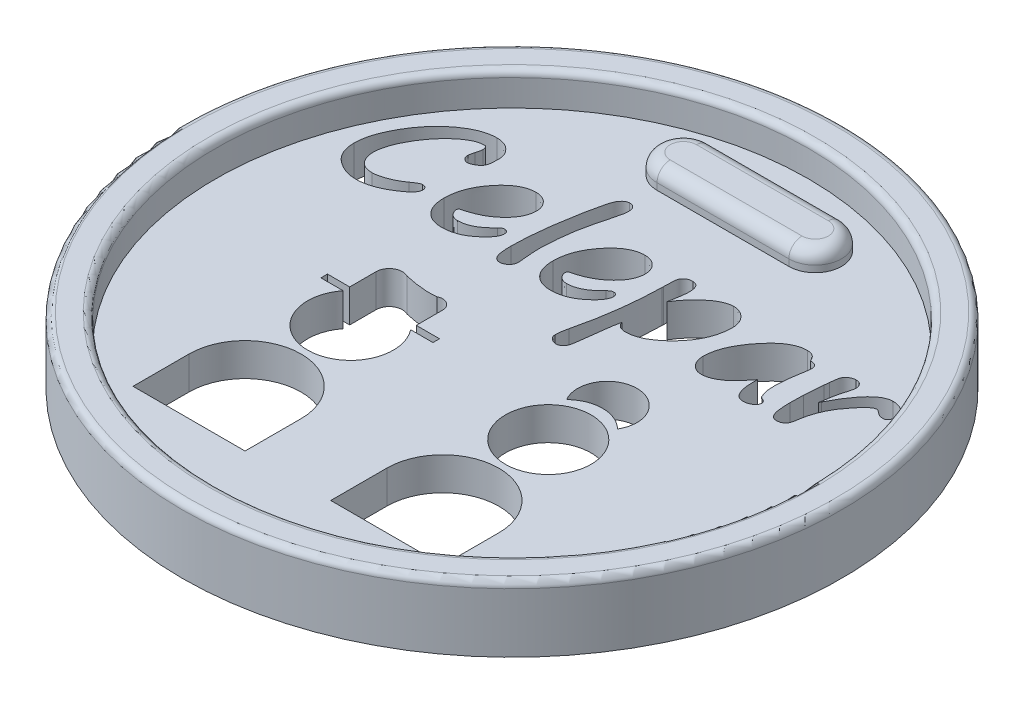
from build123d import *

# Parameters (mm, degrees)
SKETCH1_R           = 50
BOSS_EXTRUDE1_DEPTH = 10
SKETCH2_R           = 45
CUT_EXTRUDE1_DEPTH  = 5
CUT_EXTRUDE3_DEPTH  = 5
SKETCH4_R           = 6.5
CUT_EXTRUDE4_DEPTH  = 5
CUT_EXTRUDE5_DEPTH  = 5
BOSS_EXTRUDE2_DEPTH = 3
CUT_EXTRUDE9_DEPTH  = 5
CUT_EXTRUDE10_DEPTH = 5
FILLET3_R           = 1
FILLET4_R           = 2


with BuildPart() as part:
    # Sketch1 → Boss-Extrude1 (new body)
    with BuildSketch(Plane(origin=(0, 0, 0), x_dir=(1, 0, 0), z_dir=(0, 1, 0))):
        with Locations(Location((0, 0, 0), (0, 0, 270))):
            Circle(SKETCH1_R)
    extrude(amount=BOSS_EXTRUDE1_DEPTH)

    # Sketch2 → Cut-Extrude1 (cut)
    with BuildSketch(Plane(origin=(0, 10, 0), x_dir=(1, 0, 0), z_dir=(0, 1, 0))):
        with Locations(Location((0, 0, 0), (0, 0, 270))):
            Circle(SKETCH2_R)
    extrude(amount=-CUT_EXTRUDE1_DEPTH, mode=Mode.SUBTRACT)

    # Sketch3 → Cut-Extrude3 (cut)
    # profile 1 of 7: a face of its own
    with BuildSketch(Plane(origin=(0, 5, 0), x_dir=(1, 0, 0), z_dir=(0, 1, 0))):
        with BuildLine():
            add(Edge.make_bspline(
                [(-28.563958066, 14.976668611), (-28.504414468, 14.974726041), (-28.392027458, 14.971059488), (-28.236236874, 14.935447058), (-28.103393159, 14.878410499), (-27.992264837, 14.796973406), (-27.908901509, 14.68685804), (-27.849030657, 14.556229677), (-27.812800999, 14.403023682), (-27.809302498, 14.293538579), (-27.807431167, 14.234975573)],
                knots=[0, 0, 0, 0, 1.175922075, 2.219522687, 3.13882948, 4.018817675, 4.910676266, 5.838059115, 6.843589174, 8, 8, 8, 8], degree=3))
            add(Edge.make_bspline(
                [(-27.807431167, 14.234975573), (-27.815350699, 14.154926212), (-27.832269478, 13.983913893), (-27.946861005, 13.728461874), (-28.12364841, 13.462936918), (-28.367638487, 13.183557179), (-28.68240902, 12.89359431), (-29.067530825, 12.593852612), (-29.517459043, 12.275307778), (-30.024083276, 11.952178577), (-30.561692346, 11.640555951), (-31.109731426, 11.366432092), (-31.65265481, 11.134526199), (-32.190552702, 10.943614059), (-32.723674229, 10.794033502), (-33.252895244, 10.686184805), (-33.778938506, 10.622069038), (-34.128465653, 10.613718586), (-34.301695408, 10.609580004)],
                knots=[0, 0, 0, 0, 0.490997439, 1.048935432, 1.693710688, 2.446850553, 3.318610014, 4.31677211, 5.440051704, 6.701134426, 8.003547718, 9.252168074, 10.459584469, 11.62483034, 12.752871729, 13.855128834, 14.93697669, 16, 16, 16, 16], degree=3))
            add(Edge.make_bspline(
                [(-34.301695408, 10.609580004), (-34.452199777, 10.612715023), (-34.752298445, 10.618966104), (-35.196724045, 10.678097989), (-35.632941889, 10.768828796), (-36.058884592, 10.901757229), (-36.477040849, 11.06707691), (-36.886146898, 11.270149125), (-37.28435438, 11.512212559), (-37.670347842, 11.787060054), (-38.029332946, 12.098185014), (-38.343092254, 12.448034705), (-38.610922438, 12.831696822), (-38.827090515, 13.251130856), (-38.993485947, 13.705114508), (-39.115498294, 14.190048317), (-39.18704616, 14.710493974), (-39.195490993, 15.068413224), (-39.199836231, 15.252578421)],
                knots=[0, 0, 0, 0, 0.95508331, 1.904391418, 2.841495719, 3.780868837, 4.733410406, 5.693700699, 6.676790617, 7.689118492, 8.699107254, 9.686138951, 10.664969221, 11.661856379, 12.673015374, 13.72829804, 14.831109423, 16, 16, 16, 16], degree=3))
            add(Edge.make_bspline(
                [(-39.199836231, 15.252578421), (-39.195599761, 15.447657072), (-39.186965757, 15.845231034), (-39.103798446, 16.447798101), (-38.980051199, 17.067656115), (-38.802419335, 17.702089097), (-38.580611718, 18.354117617), (-38.301607084, 19.017914779), (-37.977266665, 19.699231167), (-37.60728269, 20.388485528), (-37.199337624, 21.069597119), (-36.762768195, 21.725311032), (-36.304903093, 22.351116476), (-35.823588635, 22.944075905), (-35.312729157, 23.50006827), (-34.782336603, 24.026250886), (-34.226572718, 24.519309481), (-33.652331049, 24.976146016), (-33.067836076, 25.390530095), (-32.482596876, 25.754104838), (-31.897504369, 26.055972509), (-31.321660954, 26.313921958), (-30.74426729, 26.505071423), (-30.172414672, 26.646804813), (-29.603028085, 26.733665549), (-29.223859837, 26.743793772), (-29.035674838, 26.74882051)],
                knots=[0, 0, 0, 0, 0.847673193, 1.727573926, 2.639890886, 3.594282358, 4.589527553, 5.632290013, 6.722685862, 7.869101956, 9.031879784, 10.173035523, 11.292655154, 12.401933248, 13.491379363, 14.573675912, 15.648732364, 16.71969745, 17.762273764, 18.76216988, 19.71212548, 20.622749067, 21.502397673, 22.352248691, 23.182204526, 24, 24, 24, 24], degree=3))
            add(Edge.make_bspline(
                [(-29.035674838, 26.74882051), (-28.92675849, 26.746961924), (-28.714133851, 26.743333624), (-28.403635011, 26.702728003), (-28.109514556, 26.641673116), (-27.832343528, 26.555235818), (-27.571670338, 26.446137267), (-27.33049959, 26.307204107), (-27.102773765, 26.147725863), (-26.897956723, 25.960338914), (-26.711510053, 25.759741082), (-26.547400298, 25.548394776), (-26.407753705, 25.329209241), (-26.292391598, 25.101284999), (-26.207762115, 24.863436302), (-26.144941223, 24.618254179), (-26.104395299, 24.364882817), (-26.100527609, 24.19260553), (-26.098570408, 24.105426523)],
                knots=[0, 0, 0, 0, 1.183925301, 2.31123878, 3.39976039, 4.447558897, 5.464427515, 6.466339261, 7.469116639, 8.482052617, 9.479102932, 10.445095484, 11.387997589, 12.301928294, 13.217187157, 14.127630168, 15.052508048, 16, 16, 16, 16], degree=3))
            add(Edge.make_bspline(
                [(-26.098570408, 24.105426523), (-26.100789073, 23.927373717), (-26.104898006, 23.597622835), (-26.135280693, 23.142517999), (-26.188244362, 22.767653468), (-26.266739709, 22.460804854), (-26.389306802, 22.204648141), (-26.559911509, 21.979574175), (-26.780733011, 21.772553245), (-27.043233152, 21.595028044), (-27.315037359, 21.448351853), (-27.566636927, 21.331058581), (-27.794835271, 21.260761822), (-27.939580774, 21.248250271), (-28.006204902, 21.242491396)],
                knots=[0, 0, 0, 0, 1.655393144, 3.065761008, 4.237347446, 5.171966553, 5.998538883, 6.859132817, 7.782696876, 8.800325899, 9.796079609, 10.652143033, 11.379602177, 12, 12, 12, 12], degree=3))
            add(Edge.make_bspline(
                [(-28.006204902, 21.242491396), (-28.067856028, 21.246029536), (-28.189327646, 21.253000757), (-28.364270277, 21.304899718), (-28.524963307, 21.39155505), (-28.672774575, 21.504764031), (-28.795892181, 21.650834234), (-28.882346026, 21.824978864), (-28.93789557, 22.021370276), (-28.943666999, 22.160802971), (-28.946671674, 22.233393295)],
                knots=[0, 0, 0, 0, 0.96832296, 1.907893094, 2.839715128, 3.825475609, 4.818685114, 5.812867401, 6.861352675, 8, 8, 8, 8], degree=3))
            add(Edge.make_bspline(
                [(-28.946671674, 22.233393295), (-28.944225491, 22.292907854), (-28.938843055, 22.423860181), (-28.893714829, 22.635972953), (-28.837131953, 22.885546003), (-28.781017214, 23.061508399), (-28.750864712, 23.156059434)],
                knots=[0, 0, 0, 0, 0.754148222, 1.659383275, 2.74230097, 4, 4, 4, 4], degree=3))
            add(Edge.make_bspline(
                [(-28.750864712, 23.156059434), (-28.723356446, 23.252750739), (-28.671162917, 23.436210519), (-28.609262947, 23.700858192), (-28.575923692, 23.941395916), (-28.569796588, 24.093480504), (-28.566924838, 24.164761966)],
                knots=[0, 0, 0, 0, 1.172701658, 2.225056214, 3.168090668, 4, 4, 4, 4], degree=3))
            add(Edge.make_bspline(
                [(-28.566924838, 24.164761966), (-28.567252392, 24.218313688), (-28.567868941, 24.319113226), (-28.593481512, 24.459052629), (-28.626078796, 24.579573258), (-28.67860607, 24.67803553), (-28.743284656, 24.757675018), (-28.826908552, 24.813577741), (-28.92604963, 24.842635808), (-28.995940224, 24.84751795), (-29.032708066, 24.850086333)],
                knots=[0, 0, 0, 0, 1.363882434, 2.567213775, 3.621257799, 4.53582974, 5.395465562, 6.214495348, 7.060686862, 8, 8, 8, 8], degree=3))
            add(Edge.make_bspline(
                [(-29.032708066, 24.850086333), (-29.153670056, 24.845251765), (-29.401533537, 24.835345241), (-29.778166859, 24.760203705), (-30.164371865, 24.637150449), (-30.560791133, 24.465345127), (-30.967484707, 24.247934971), (-31.383462345, 23.981090198), (-31.811987932, 23.668666134), (-32.243967534, 23.308863531), (-32.678491894, 22.918887622), (-33.094942039, 22.495730017), (-33.500122694, 22.053541454), (-33.888511461, 21.586774263), (-34.263152338, 21.09784586), (-34.617594223, 20.583165915), (-34.961536515, 20.048889726), (-35.278956747, 19.493717319), (-35.574469679, 18.938253002), (-35.828180219, 18.390168729), (-36.052564393, 17.863334187), (-36.224889964, 17.348081776), (-36.368064501, 16.853182505), (-36.465455073, 16.372942645), (-36.52825656, 15.909896047), (-36.537226961, 15.605810494), (-36.541608383, 15.4572857)],
                knots=[0, 0, 0, 0, 0.679891051, 1.393166261, 2.151189153, 2.955854646, 3.819108012, 4.74163671, 5.732685108, 6.799283363, 7.901667624, 9.014479954, 10.136314935, 11.273386669, 12.427880066, 13.598704419, 14.786520549, 15.999798709, 17.193781982, 18.323240499, 19.395217907, 20.411667901, 21.376421926, 22.290345904, 23.164952033, 24, 24, 24, 24], degree=3))
            add(Edge.make_bspline(
                [(-36.541608383, 15.4572857), (-36.538816045, 15.362302796), (-36.53333429, 15.175837846), (-36.505386617, 14.901367958), (-36.449166534, 14.639421147), (-36.381527945, 14.386482869), (-36.282839166, 14.148195302), (-36.17142421, 13.917094617), (-36.034506226, 13.699624281), (-35.880743595, 13.493336206), (-35.705917167, 13.305859824), (-35.509448848, 13.141016915), (-35.290575044, 13.005117669), (-35.055435743, 12.8909641), (-34.799945461, 12.805129476), (-34.526521676, 12.743919067), (-34.233662022, 12.703564397), (-34.031859641, 12.700015927), (-33.927882117, 12.698187598)],
                knots=[0, 0, 0, 0, 1.062708041, 2.086247047, 3.079703908, 4.056583884, 5.009566657, 5.959270479, 6.922975603, 7.878586239, 8.833236301, 9.783455216, 10.737784872, 11.707374597, 12.700708315, 13.744425971, 14.837828359, 16, 16, 16, 16], degree=3))
            add(Edge.make_bspline(
                [(-33.927882117, 12.698187598), (-33.794089918, 12.70425344), (-33.507808202, 12.717232817), (-33.055168294, 12.800459537), (-32.553834824, 12.932289466), (-32.015072939, 13.114710028), (-31.461699941, 13.337259003), (-30.919310287, 13.602756909), (-30.398294275, 13.904687845), (-30.069518059, 14.134679889), (-29.904939079, 14.249809434)],
                knots=[0, 0, 0, 0, 0.735103209, 1.572936311, 2.52174827, 3.581825056, 4.69567354, 5.796405863, 6.896923624, 8, 8, 8, 8], degree=3))
            add(Edge.make_bspline(
                [(-29.904939079, 14.249809434), (-29.826002893, 14.306426404), (-29.675963673, 14.414042017), (-29.46032557, 14.562928865), (-29.263277902, 14.688429911), (-29.08669489, 14.792366805), (-28.928886797, 14.874430567), (-28.7899988, 14.931217537), (-28.670498582, 14.966937017), (-28.596760103, 14.973672417), (-28.563958066, 14.976668611)],
                knots=[0, 0, 0, 0, 1.513238956, 2.876313183, 4.081465863, 5.151542836, 6.067858844, 6.848826273, 7.487908581, 8, 8, 8, 8], degree=3))
        make_face()
    # profile 2 of 7: a face of its own
    with BuildSketch(Plane(origin=(0, 5, 0), x_dir=(1, 0, 0), z_dir=(0, 1, 0))):
        with BuildLine():
            add(Edge.make_bspline(
                [(-15.845405851, 14.691858485), (-15.850730141, 14.603242927), (-15.861835223, 14.418413957), (-15.95285415, 14.139599782), (-16.092127819, 13.849737342), (-16.284143669, 13.546028196), (-16.533315651, 13.232591935), (-16.834506125, 12.906200428), (-17.190547864, 12.567927661), (-17.590035951, 12.222257312), (-18.02370685, 11.89017051), (-18.482394016, 11.598722511), (-18.954812514, 11.35005111), (-19.443925093, 11.152558257), (-19.944285618, 10.993180331), (-20.459495013, 10.879981088), (-20.990064451, 10.814355749), (-21.348589617, 10.80445564), (-21.529741294, 10.799453421)],
                knots=[0, 0, 0, 0, 0.575450738, 1.200240343, 1.890844749, 2.665472192, 3.531532002, 4.492194963, 5.552302139, 6.724526169, 7.927501424, 9.101753601, 10.255563892, 11.395209824, 12.528446857, 13.667874897, 14.821649321, 16, 16, 16, 16], degree=3))
            add(Edge.make_bspline(
                [(-21.529741294, 10.799453421), (-21.666372045, 10.802940292), (-21.933667107, 10.809761768), (-22.323057681, 10.860973319), (-22.689855969, 10.943442745), (-23.034750122, 11.059091366), (-23.35643211, 11.211913638), (-23.657698198, 11.395821113), (-23.935077329, 11.61423615), (-24.189082783, 11.864090486), (-24.412417477, 12.147296589), (-24.613833904, 12.453172954), (-24.780427366, 12.788010591), (-24.912611557, 13.150068435), (-25.020015665, 13.536775964), (-25.096581656, 13.949610618), (-25.141129716, 14.388258736), (-25.146463453, 14.68878681), (-25.149203319, 14.843163864)],
                knots=[0, 0, 0, 0, 1.066394267, 2.086220858, 3.060099066, 3.997587095, 4.919658394, 5.834591807, 6.74734032, 7.669928585, 8.60916332, 9.557774692, 10.524496789, 11.521150538, 12.562548157, 13.654267586, 14.795030173, 16, 16, 16, 16], degree=3))
            add(Edge.make_bspline(
                [(-25.149203319, 14.843163864), (-25.144147322, 15.075922409), (-25.134078465, 15.539453683), (-25.032768608, 16.22795323), (-24.881472119, 16.907247314), (-24.658309221, 17.573124124), (-24.379041743, 18.228710747), (-24.03536748, 18.872778597), (-23.626913095, 19.50377172), (-23.168257646, 20.114821293), (-22.674613087, 20.6820999), (-22.166218533, 21.187290508), (-21.643608078, 21.611380571), (-21.116003919, 21.962434819), (-20.575820011, 22.233432841), (-20.02803905, 22.427330395), (-19.470227037, 22.549419614), (-19.094621472, 22.56421786), (-18.907114712, 22.57160532)],
                knots=[0, 0, 0, 0, 1.031222844, 2.053647655, 3.078916673, 4.113182563, 5.162064125, 6.23490753, 7.345231, 8.491265058, 9.619269909, 10.676447627, 11.664492445, 12.598371341, 13.480677529, 14.336228692, 15.169425597, 16, 16, 16, 16], degree=3))
            add(Edge.make_bspline(
                [(-18.907114712, 22.57160532), (-18.816056857, 22.569096076), (-18.63730521, 22.564170289), (-18.375664921, 22.532325852), (-18.127978681, 22.474293288), (-17.891410331, 22.399730305), (-17.672956283, 22.293024383), (-17.465031049, 22.172356955), (-17.274016541, 22.024458545), (-17.097836496, 21.856759681), (-16.939594363, 21.67372232), (-16.797503281, 21.482613494), (-16.67922055, 21.281656705), (-16.583619264, 21.070263458), (-16.505987468, 20.852424653), (-16.452022939, 20.624666495), (-16.423198593, 20.388804196), (-16.417777831, 20.22891606), (-16.415026104, 20.147752472)],
                knots=[0, 0, 0, 0, 1.124451236, 2.207360486, 3.247069246, 4.262619894, 5.262188273, 6.242249166, 7.22648491, 8.237031366, 9.240990529, 10.210574094, 11.173909432, 12.113741425, 13.071488564, 14.025179417, 14.997527084, 16, 16, 16, 16], degree=3))
            add(Edge.make_bspline(
                [(-16.415026104, 20.147752472), (-16.420480844, 20.002067224), (-16.431428166, 19.709686014), (-16.510626119, 19.275007975), (-16.643159082, 18.846289567), (-16.82927119, 18.422937669), (-17.067433561, 18.004852832), (-17.358821926, 17.592728274), (-17.701262189, 17.186938814), (-18.090926056, 16.789303162), (-18.520193639, 16.409202881), (-18.985251341, 16.058400475), (-19.478653785, 15.738529404), (-19.999477685, 15.445153873), (-20.553027085, 15.188285129), (-21.134996782, 14.960891043), (-21.745139047, 14.758581276), (-22.166790276, 14.655349763), (-22.381204902, 14.60285532)],
                knots=[0, 0, 0, 0, 0.800849327, 1.607254681, 2.420833415, 3.263389909, 4.144929825, 5.06217423, 6.034821359, 7.061524084, 8.120941185, 9.184578394, 10.261477047, 11.352140241, 12.468738872, 13.613838751, 14.786608846, 16, 16, 16, 16], degree=3))
            add(Edge.make_bspline(
                [(-22.381204902, 14.60285532), (-22.425792705, 14.588589288), (-22.508765494, 14.562041839), (-22.613867236, 14.48447275), (-22.672648361, 14.369631114), (-22.678037272, 14.28504249), (-22.680848889, 14.240909117)],
                knots=[0, 0, 0, 0, 1.091319623, 2.030820704, 2.972597988, 4, 4, 4, 4], degree=3))
            add(Edge.make_bspline(
                [(-22.680848889, 14.240909117), (-22.675725935, 14.16107767), (-22.665350449, 13.999395562), (-22.577566493, 13.763402249), (-22.446074931, 13.532544533), (-22.262769354, 13.316099013), (-22.03759371, 13.124494949), (-21.767292218, 12.987547777), (-21.462888972, 12.900356226), (-21.247546813, 12.89227735), (-21.135160598, 12.888061016)],
                knots=[0, 0, 0, 0, 0.841016686, 1.703305588, 2.62977901, 3.638315365, 4.684301175, 5.730912823, 6.815772435, 8, 8, 8, 8], degree=3))
            add(Edge.make_bspline(
                [(-21.135160598, 12.888061016), (-20.969519024, 12.894365197), (-20.635397977, 12.907081566), (-20.136681602, 13.011268542), (-19.637712008, 13.171789961), (-19.140539321, 13.399791449), (-18.645832543, 13.693982073), (-18.152801379, 14.052992592), (-17.659420032, 14.474349278), (-17.347181134, 14.792211223), (-17.186386864, 14.955901206)],
                knots=[0, 0, 0, 0, 0.866839858, 1.74853109, 2.657591878, 3.607915725, 4.606351584, 5.667263571, 6.798706195, 8, 8, 8, 8], degree=3))
            add(Edge.make_bspline(
                [(-17.186386864, 14.955901206), (-17.124979767, 15.016578633), (-17.01015796, 15.130036071), (-16.819983218, 15.255810721), (-16.633783449, 15.342615328), (-16.505832697, 15.351953416), (-16.444693826, 15.356415447)],
                knots=[0, 0, 0, 0, 1.194390874, 2.233326893, 3.155828328, 4, 4, 4, 4], degree=3))
            add(Edge.make_bspline(
                [(-16.444693826, 15.356415447), (-16.397929613, 15.355539026), (-16.30901417, 15.353872637), (-16.185893088, 15.318960177), (-16.077250919, 15.269600475), (-15.990816492, 15.19329455), (-15.921489814, 15.097653737), (-15.880749769, 14.978984753), (-15.848107062, 14.842933406), (-15.846347571, 14.744527591), (-15.845405851, 14.691858485)],
                knots=[0, 0, 0, 0, 1.089782762, 2.0720656, 2.972437849, 3.858422398, 4.738038329, 5.704937711, 6.77162871, 8, 8, 8, 8], degree=3))
        make_face()
        with BuildLine():
            add(Edge.make_bspline(
                [(-22.50284256, 16.463021459), (-22.371893777, 16.492044144), (-22.112920638, 16.549441363), (-21.733416147, 16.663775652), (-21.366829064, 16.799606447), (-21.010996674, 16.958018832), (-20.666756785, 17.138768351), (-20.334870542, 17.343258322), (-20.016237285, 17.57104749), (-19.712117643, 17.812485217), (-19.43334619, 18.064920557), (-19.187892811, 18.315802815), (-18.977396721, 18.55899258), (-18.807391286, 18.797774011), (-18.670227853, 19.02958339), (-18.575490419, 19.258309186), (-18.513956887, 19.480964314), (-18.507010104, 19.62820514), (-18.503633699, 19.699769877)],
                knots=[0, 0, 0, 0, 1.183770719, 2.341104769, 3.495768463, 4.633072806, 5.777292541, 6.925767626, 8.071584969, 9.233257558, 10.352014072, 11.389210071, 12.330478683, 13.188063196, 13.974238553, 14.702222648, 15.369230003, 16, 16, 16, 16], degree=3))
            add(Edge.make_bspline(
                [(-18.503633699, 19.699769877), (-18.505597018, 19.753442697), (-18.509389502, 19.857120851), (-18.547671312, 20.004768101), (-18.602143045, 20.141738049), (-18.68666055, 20.258049606), (-18.783613457, 20.35847576), (-18.898226266, 20.431167448), (-19.027734507, 20.474652397), (-19.118405759, 20.480155959), (-19.165223889, 20.482997725)],
                knots=[0, 0, 0, 0, 1.123927722, 2.171056977, 3.184948799, 4.198415598, 5.167106761, 6.100000299, 7.018934543, 8, 8, 8, 8], degree=3))
            add(Edge.make_bspline(
                [(-19.165223889, 20.482997725), (-19.238724821, 20.4784365), (-19.390893056, 20.468993441), (-19.620799209, 20.407179544), (-19.854041091, 20.301962394), (-20.096483198, 20.163472177), (-20.337229113, 19.974088349), (-20.591736545, 19.756304027), (-20.846037345, 19.491019138), (-21.104182222, 19.194839939), (-21.356011327, 18.876925091), (-21.586934274, 18.547549652), (-21.796863408, 18.213323665), (-21.982013655, 17.872553801), (-22.150231243, 17.529583281), (-22.289548574, 17.178787486), (-22.408813195, 16.824231876), (-22.471588469, 16.583082924), (-22.50284256, 16.463021459)],
                knots=[0, 0, 0, 0, 0.642491747, 1.330144142, 2.06562385, 2.87509469, 3.76367731, 4.737815052, 5.801380817, 6.97148196, 8.171592185, 9.344244655, 10.485872232, 11.619289626, 12.73268851, 13.822553391, 14.915908914, 16, 16, 16, 16], degree=3))
        make_face(mode=Mode.SUBTRACT)
    # profile 3 of 7: a face of its own
    with BuildSketch(Plane(origin=(0, 5, 0), x_dir=(1, 0, 0), z_dir=(0, 1, 0))):
        with BuildLine():
            add(Edge.make_bspline(
                [(-10.457747623, 28.267807852), (-10.374358396, 28.264948438), (-10.215317165, 28.25949492), (-9.993494459, 28.203880502), (-9.805562753, 28.108925551), (-9.648282336, 27.979558855), (-9.532675912, 27.805917994), (-9.444311237, 27.601573593), (-9.400181084, 27.357809115), (-9.393351341, 27.1850716), (-9.389709648, 27.092966079)],
                knots=[0, 0, 0, 0, 1.099591197, 2.097157424, 2.990591671, 3.861609203, 4.752654967, 5.717909776, 6.783164693, 8, 8, 8, 8], degree=3))
            add(Edge.make_bspline(
                [(-9.389709648, 27.092966079), (-9.396877995, 26.905581426), (-9.411856794, 26.514027101), (-9.500720108, 26.06662706), (-9.584562529, 25.726299407), (-9.643255132, 25.483830634), (-9.71782131, 25.184292665), (-9.806207916, 24.827867939), (-9.913635109, 24.414645728), (-10.039352798, 23.944728365), (-10.174306693, 23.41474092), (-10.272506301, 23.043240532), (-10.324242876, 22.84751513)],
                knots=[0, 0, 0, 0, 1.289829287, 2.695195295, 3.129646155, 3.704501762, 4.413150189, 5.25559708, 6.233531093, 7.353588569, 8.605735134, 10, 10, 10, 10], degree=3))
            add(Edge.make_bspline(
                [(-10.324242876, 22.84751513), (-10.401038878, 22.544519454), (-10.557422118, 21.927515388), (-10.746418721, 20.973390237), (-10.913837467, 19.979377077), (-11.024511773, 19.130230886), (-11.097885747, 18.451883632), (-11.148003613, 17.968270979), (-11.194821624, 17.514710295), (-11.225824422, 17.089123526), (-11.252936934, 16.69159356), (-11.274273902, 16.322772074), (-11.287108718, 15.982498884), (-11.288011239, 15.765839805), (-11.288443826, 15.661992978)],
                knots=[0, 0, 0, 0, 1.548613178, 3.153512418, 4.817868451, 6.542840943, 7.395678594, 8.198748891, 8.952079032, 9.654882466, 10.312993058, 10.926481874, 11.485452204, 12, 12, 12, 12], degree=3))
            add(Edge.make_bspline(
                [(-11.288443826, 15.661992978), (-11.285938617, 15.44142131), (-11.280689413, 14.979253821), (-11.242590655, 14.257098364), (-11.183482175, 13.474616244), (-11.127607527, 12.934418), (-11.098570408, 12.653686016)],
                knots=[0, 0, 0, 0, 0.877690488, 1.839039493, 2.876985002, 4, 4, 4, 4], degree=3))
            add(Edge.make_bspline(
                [(-11.098570408, 12.653686016), (-11.091967553, 12.582450619), (-11.080133224, 12.45477507), (-11.060375084, 12.286054763), (-11.051025289, 12.160317087), (-11.048960323, 12.090995335), (-11.048135281, 12.063298358)],
                knots=[0, 0, 0, 0, 1.448388172, 2.595953158, 3.439023807, 4, 4, 4, 4], degree=3))
            add(Edge.make_bspline(
                [(-11.048135281, 12.063298358), (-11.052785683, 11.966724816), (-11.061935557, 11.776712027), (-11.14955814, 11.503410469), (-11.292032701, 11.25197766), (-11.486873281, 11.033035152), (-11.70795399, 10.846566932), (-11.9482596, 10.710800744), (-12.199470185, 10.624961588), (-12.371659502, 10.614691209), (-12.457352053, 10.609580004)],
                knots=[0, 0, 0, 0, 1.036390902, 2.039145728, 3.05390599, 4.124779255, 5.17500197, 6.151509149, 7.080071284, 8, 8, 8, 8], degree=3))
            add(Edge.make_bspline(
                [(-12.457352053, 10.609580004), (-12.514794203, 10.612324407), (-12.626497379, 10.617661231), (-12.788375341, 10.645548896), (-12.934548159, 10.700607268), (-13.069435048, 10.773078384), (-13.190931923, 10.868223549), (-13.29785385, 10.985290281), (-13.391735331, 11.122024398), (-13.471394931, 11.280975279), (-13.540278063, 11.466094001), (-13.59745362, 11.678944228), (-13.649289825, 11.921285473), (-13.684445409, 12.193400622), (-13.718397964, 12.494881529), (-13.741990594, 12.826410928), (-13.752015007, 13.188633149), (-13.755162752, 13.439877285), (-13.756798256, 13.570418611)],
                knots=[0, 0, 0, 0, 0.763621813, 1.484954553, 2.170605734, 2.828914735, 3.512045132, 4.209174533, 4.926910776, 5.708176713, 6.564454032, 7.545959403, 8.633048804, 9.853445002, 11.187893763, 12.662727541, 14.266021329, 16, 16, 16, 16], degree=3))
            add(Edge.make_bspline(
                [(-13.756798256, 13.570418611), (-13.754580457, 13.868122086), (-13.750039936, 14.477613383), (-13.70961049, 15.410506781), (-13.643308482, 16.382720705), (-13.553897494, 17.392564979), (-13.442263828, 18.442399769), (-13.297621085, 19.529895471), (-13.131521911, 20.657389443), (-12.975994078, 21.614253027), (-12.842070341, 22.376964174), (-12.745111956, 22.925196039), (-12.64557997, 23.441732758), (-12.556017355, 23.92913687), (-12.462186955, 24.384488567), (-12.374126277, 24.809921536), (-12.28853998, 25.206840149), (-12.201897106, 25.57116871), (-12.122678439, 25.907147278), (-12.042411078, 26.210494723), (-11.966079221, 26.486035609), (-11.888012888, 26.729424915), (-11.81951137, 26.944810163), (-11.74617729, 27.126755963), (-11.68080054, 27.280652173), (-11.593652215, 27.441014122), (-11.485491124, 27.608838903), (-11.347319376, 27.781906617), (-11.208753268, 27.931156736), (-11.066948447, 28.055074918), (-10.918694851, 28.147451857), (-10.770452029, 28.218582682), (-10.614977167, 28.257878913), (-10.510356613, 28.26448563), (-10.457747623, 28.267807852)],
                knots=[0, 0, 0, 0, 1.836544728, 3.75997636, 5.759493323, 7.847949033, 10.0140229, 12.272136872, 14.615532806, 17.044786909, 18.252418395, 19.392902382, 20.479383494, 21.497655588, 22.450066657, 23.347464778, 24.177954725, 24.95488479, 25.65776484, 26.30739308, 26.890663253, 27.42130466, 27.88433336, 28.284259091, 28.631155274, 28.915029276, 29.409167659, 29.860801991, 30.279461553, 30.664594642, 31.018343889, 31.354117303, 31.675214529, 32, 32, 32, 32], degree=3))
        make_face()
    # profile 4 of 7: a face of its own
    with BuildSketch(Plane(origin=(0, 5, 0), x_dir=(1, 0, 0), z_dir=(0, 1, 0))):
        with BuildLine():
            add(Edge.make_bspline(
                [(0.673581491, 14.691858485), (0.668257201, 14.603242927), (0.657152119, 14.418413957), (0.566133191, 14.139599782), (0.426859523, 13.849737342), (0.234843673, 13.546028196), (-0.014328309, 13.232591935), (-0.315518783, 12.906200428), (-0.671560522, 12.567927661), (-1.071048609, 12.222257312), (-1.504719508, 11.89017051), (-1.963406674, 11.598722511), (-2.435825172, 11.35005111), (-2.924937751, 11.152558257), (-3.425298276, 10.993180331), (-3.940507671, 10.879981088), (-4.471077109, 10.814355749), (-4.829602275, 10.80445564), (-5.010753952, 10.799453421)],
                knots=[0, 0, 0, 0, 0.575450738, 1.200240343, 1.890844749, 2.665472192, 3.531532002, 4.492194963, 5.552302139, 6.724526169, 7.927501424, 9.101753601, 10.255563892, 11.395209824, 12.528446857, 13.667874897, 14.821649321, 16, 16, 16, 16], degree=3))
            add(Edge.make_bspline(
                [(-5.010753952, 10.799453421), (-5.147384703, 10.802940292), (-5.414679766, 10.809761768), (-5.804070339, 10.860973319), (-6.170868627, 10.943442745), (-6.51576278, 11.059091366), (-6.837444769, 11.211913638), (-7.138710856, 11.395821113), (-7.416089988, 11.61423615), (-7.670095441, 11.864090486), (-7.893430136, 12.147296589), (-8.094846563, 12.453172954), (-8.261440024, 12.788010591), (-8.393624215, 13.150068435), (-8.501028323, 13.536775964), (-8.577594314, 13.949610618), (-8.622142374, 14.388258736), (-8.627476111, 14.68878681), (-8.630215977, 14.843163864)],
                knots=[0, 0, 0, 0, 1.066394267, 2.086220858, 3.060099066, 3.997587095, 4.919658394, 5.834591807, 6.74734032, 7.669928585, 8.60916332, 9.557774692, 10.524496789, 11.521150538, 12.562548157, 13.654267586, 14.795030173, 16, 16, 16, 16], degree=3))
            add(Edge.make_bspline(
                [(-8.630215977, 14.843163864), (-8.625159981, 15.075922409), (-8.615091123, 15.539453683), (-8.513781266, 16.22795323), (-8.362484777, 16.907247314), (-8.139321879, 17.573124124), (-7.860054401, 18.228710747), (-7.516380139, 18.872778597), (-7.107925753, 19.50377172), (-6.649270305, 20.114821293), (-6.155625745, 20.6820999), (-5.647231191, 21.187290508), (-5.124620737, 21.611380571), (-4.597016577, 21.962434819), (-4.05683267, 22.233432841), (-3.509051708, 22.427330395), (-2.951239695, 22.549419614), (-2.57563413, 22.56421786), (-2.38812737, 22.57160532)],
                knots=[0, 0, 0, 0, 1.031222844, 2.053647655, 3.078916673, 4.113182563, 5.162064125, 6.23490753, 7.345231, 8.491265058, 9.619269909, 10.676447627, 11.664492445, 12.598371341, 13.480677529, 14.336228692, 15.169425597, 16, 16, 16, 16], degree=3))
            add(Edge.make_bspline(
                [(-2.38812737, 22.57160532), (-2.297069515, 22.569096076), (-2.118317868, 22.564170289), (-1.856677579, 22.532325852), (-1.608991339, 22.474293288), (-1.372422989, 22.399730305), (-1.153968941, 22.293024383), (-0.946043707, 22.172356955), (-0.7550292, 22.024458545), (-0.578849154, 21.856759681), (-0.420607021, 21.67372232), (-0.278515939, 21.482613494), (-0.160233209, 21.281656705), (-0.064631922, 21.070263458), (0.012999873, 20.852424653), (0.066964403, 20.624666495), (0.095788749, 20.388804196), (0.101209511, 20.22891606), (0.103961238, 20.147752472)],
                knots=[0, 0, 0, 0, 1.124451236, 2.207360486, 3.247069246, 4.262619894, 5.262188273, 6.242249166, 7.22648491, 8.237031366, 9.240990529, 10.210574094, 11.173909432, 12.113741425, 13.071488564, 14.025179417, 14.997527084, 16, 16, 16, 16], degree=3))
            add(Edge.make_bspline(
                [(0.103961238, 20.147752472), (0.098506498, 20.002067224), (0.087559176, 19.709686014), (0.008361223, 19.275007975), (-0.124171741, 18.846289567), (-0.310283848, 18.422937669), (-0.548446219, 18.004852832), (-0.839834584, 17.592728274), (-1.182274848, 17.186938814), (-1.571938714, 16.789303162), (-2.001206298, 16.409202881), (-2.466263999, 16.058400475), (-2.959666443, 15.738529404), (-3.480490343, 15.445153873), (-4.034039743, 15.188285129), (-4.61600944, 14.960891043), (-5.226151705, 14.758581276), (-5.647802934, 14.655349763), (-5.86221756, 14.60285532)],
                knots=[0, 0, 0, 0, 0.800849327, 1.607254681, 2.420833415, 3.263389909, 4.144929825, 5.06217423, 6.034821359, 7.061524084, 8.120941185, 9.184578394, 10.261477047, 11.352140241, 12.468738872, 13.613838751, 14.786608846, 16, 16, 16, 16], degree=3))
            add(Edge.make_bspline(
                [(-5.86221756, 14.60285532), (-5.906805363, 14.588589288), (-5.989778153, 14.562041839), (-6.094879894, 14.48447275), (-6.153661019, 14.369631114), (-6.15904993, 14.28504249), (-6.161861547, 14.240909117)],
                knots=[0, 0, 0, 0, 1.091319623, 2.030820704, 2.972597988, 4, 4, 4, 4], degree=3))
            add(Edge.make_bspline(
                [(-6.161861547, 14.240909117), (-6.156738593, 14.16107767), (-6.146363107, 13.999395562), (-6.058579152, 13.763402249), (-5.927087589, 13.532544533), (-5.743782012, 13.316099013), (-5.518606369, 13.124494949), (-5.248304876, 12.987547777), (-4.94390163, 12.900356226), (-4.728559471, 12.89227735), (-4.616173256, 12.888061016)],
                knots=[0, 0, 0, 0, 0.841016686, 1.703305588, 2.62977901, 3.638315365, 4.684301175, 5.730912823, 6.815772435, 8, 8, 8, 8], degree=3))
            add(Edge.make_bspline(
                [(-4.616173256, 12.888061016), (-4.450531682, 12.894365197), (-4.116410635, 12.907081566), (-3.61769426, 13.011268542), (-3.118724666, 13.171789961), (-2.621551979, 13.399791449), (-2.126845201, 13.693982073), (-1.633814037, 14.052992592), (-1.14043269, 14.474349278), (-0.828193793, 14.792211223), (-0.667399522, 14.955901206)],
                knots=[0, 0, 0, 0, 0.866839858, 1.74853109, 2.657591878, 3.607915725, 4.606351584, 5.667263571, 6.798706195, 8, 8, 8, 8], degree=3))
            add(Edge.make_bspline(
                [(-0.667399522, 14.955901206), (-0.605992426, 15.016578633), (-0.491170618, 15.130036071), (-0.300995877, 15.255810721), (-0.114796107, 15.342615328), (0.013154645, 15.351953416), (0.074293516, 15.356415447)],
                knots=[0, 0, 0, 0, 1.194390874, 2.233326893, 3.155828328, 4, 4, 4, 4], degree=3))
            add(Edge.make_bspline(
                [(0.074293516, 15.356415447), (0.121057729, 15.355539026), (0.209973171, 15.353872637), (0.333094254, 15.318960177), (0.441736423, 15.269600475), (0.52817085, 15.19329455), (0.597497528, 15.097653737), (0.638237573, 14.978984753), (0.67088028, 14.842933406), (0.67263977, 14.744527591), (0.673581491, 14.691858485)],
                knots=[0, 0, 0, 0, 1.089782762, 2.0720656, 2.972437849, 3.858422398, 4.738038329, 5.704937711, 6.77162871, 8, 8, 8, 8], degree=3))
        make_face()
        with BuildLine():
            add(Edge.make_bspline(
                [(-5.983855218, 16.463021459), (-5.852906435, 16.492044144), (-5.593933296, 16.549441363), (-5.214428805, 16.663775652), (-4.847841722, 16.799606447), (-4.492009332, 16.958018832), (-4.147769443, 17.138768351), (-3.8158832, 17.343258322), (-3.497249944, 17.57104749), (-3.193130301, 17.812485217), (-2.914358848, 18.064920557), (-2.668905469, 18.315802815), (-2.45840938, 18.55899258), (-2.288403944, 18.797774011), (-2.151240512, 19.02958339), (-2.056503077, 19.258309186), (-1.994969545, 19.480964314), (-1.988022762, 19.62820514), (-1.984646357, 19.699769877)],
                knots=[0, 0, 0, 0, 1.183770719, 2.341104769, 3.495768463, 4.633072806, 5.777292541, 6.925767626, 8.071584969, 9.233257558, 10.352014072, 11.389210071, 12.330478683, 13.188063196, 13.974238553, 14.702222648, 15.369230003, 16, 16, 16, 16], degree=3))
            add(Edge.make_bspline(
                [(-1.984646357, 19.699769877), (-1.986609676, 19.753442697), (-1.99040216, 19.857120851), (-2.02868397, 20.004768101), (-2.083155703, 20.141738049), (-2.167673208, 20.258049606), (-2.264626115, 20.35847576), (-2.379238924, 20.431167448), (-2.508747166, 20.474652397), (-2.599418417, 20.480155959), (-2.646236547, 20.482997725)],
                knots=[0, 0, 0, 0, 1.123927722, 2.171056977, 3.184948799, 4.198415598, 5.167106761, 6.100000299, 7.018934543, 8, 8, 8, 8], degree=3))
            add(Edge.make_bspline(
                [(-2.646236547, 20.482997725), (-2.71973748, 20.4784365), (-2.871905714, 20.468993441), (-3.101811867, 20.407179544), (-3.335053749, 20.301962394), (-3.577495856, 20.163472177), (-3.818241771, 19.974088349), (-4.072749204, 19.756304027), (-4.327050003, 19.491019138), (-4.58519488, 19.194839939), (-4.837023985, 18.876925091), (-5.067946933, 18.547549652), (-5.277876067, 18.213323665), (-5.463026313, 17.872553801), (-5.631243901, 17.529583281), (-5.770561233, 17.178787486), (-5.889825853, 16.824231876), (-5.952601127, 16.583082924), (-5.983855218, 16.463021459)],
                knots=[0, 0, 0, 0, 0.642491747, 1.330144142, 2.06562385, 2.87509469, 3.76367731, 4.737815052, 5.801380817, 6.97148196, 8.171592185, 9.344244655, 10.485872232, 11.619289626, 12.73268851, 13.822553391, 14.915908914, 16, 16, 16, 16], degree=3))
        make_face(mode=Mode.SUBTRACT)
    # profile 5 of 7: a face of its own
    with BuildSketch(Plane(origin=(0, 5, 0), x_dir=(1, 0, 0), z_dir=(0, 1, 0))):
        with BuildLine():
            add(Edge.make_bspline(
                [(4.68465744, 11.968361649), (4.654112383, 11.836033543), (4.586222288, 11.541918283), (4.495675312, 11.052135088), (4.408449203, 10.47101435), (4.354520885, 10.052927409), (4.32567801, 9.829318928)],
                knots=[0, 0, 0, 0, 0.750911562, 1.668991994, 2.753290027, 4, 4, 4, 4], degree=3))
            Line((4.32567801, 9.829318928), (3.818359972, 5.868678105))
            add(Edge.make_bspline(
                [(3.818359972, 5.868678105), (3.796909224, 5.719704191), (3.757012047, 5.442621139), (3.654624763, 5.067649856), (3.527133408, 4.761942913), (3.364227286, 4.529463034), (3.176667829, 4.359555505), (2.970668303, 4.242379304), (2.745639748, 4.166229554), (2.587767614, 4.158060623), (2.507046681, 4.153883801)],
                knots=[0, 0, 0, 0, 1.511178623, 2.81070675, 3.896392996, 4.822870309, 5.639073145, 6.418070304, 7.19115022, 8, 8, 8, 8], degree=3))
            add(Edge.make_bspline(
                [(2.507046681, 4.153883801), (2.432325291, 4.157530548), (2.281972799, 4.164868439), (2.062454504, 4.236886499), (1.845879553, 4.339377227), (1.64700449, 4.487464419), (1.471743364, 4.655660643), (1.339280338, 4.841576867), (1.26018539, 5.040944872), (1.248834248, 5.177764994), (1.243201744, 5.245655953)],
                knots=[0, 0, 0, 0, 0.980372226, 1.972680231, 3.014617252, 4.123650464, 5.218850957, 6.200863252, 7.107257629, 8, 8, 8, 8], degree=3))
            add(Edge.make_bspline(
                [(1.243201744, 5.245655953), (1.24609686, 5.387191391), (1.252124662, 5.68187647), (1.303147296, 6.139520444), (1.383079689, 6.628562063), (1.457112337, 6.962755974), (1.495377377, 7.135489814)],
                knots=[0, 0, 0, 0, 0.888769835, 1.850470887, 2.888979105, 4, 4, 4, 4], degree=3))
            add(Edge.make_bspline(
                [(1.495377377, 7.135489814), (1.617318066, 7.638114603), (1.861586749, 8.6449606), (2.169559017, 10.171585356), (2.44114105, 11.710491277), (2.665849264, 13.265017383), (2.849799224, 14.833052443), (2.991243123, 16.414946254), (3.095531655, 18.010510459), (3.126417784, 19.079571319), (3.141935921, 19.616700257)],
                knots=[0, 0, 0, 0, 0.983882946, 1.970890866, 2.962230422, 3.956534473, 4.958604425, 5.965445797, 6.977777618, 8, 8, 8, 8], degree=3))
            Line((3.141935921, 19.616700257), (3.141935921, 19.821407535))
            add(Edge.make_bspline(
                [(3.141935921, 19.821407535), (3.141312771, 19.929207253), (3.140117809, 20.135925573), (3.148243351, 20.431564384), (3.152285076, 20.699651635), (3.162970932, 20.938866946), (3.168885291, 21.14982302), (3.185816455, 21.331555334), (3.199253001, 21.486102603), (3.221605649, 21.654845394), (3.268758504, 21.843326511), (3.363175867, 22.051456731), (3.49228526, 22.245842822), (3.655461859, 22.423959307), (3.854876783, 22.580847947), (4.100711274, 22.684135017), (4.380286336, 22.752772457), (4.579355315, 22.758466658), (4.68465744, 22.761478738)],
                knots=[0, 0, 0, 0, 1.348735683, 2.58635532, 3.700265225, 4.70322389, 5.582542043, 6.339870431, 6.986271577, 7.523496345, 8.468851935, 9.404848546, 10.369205338, 11.37635333, 12.418247163, 13.515050408, 14.685528629, 16, 16, 16, 16], degree=3))
            add(Edge.make_bspline(
                [(4.68465744, 22.761478738), (4.772249811, 22.756543743), (4.940317095, 22.747074754), (5.176160618, 22.669436659), (5.374050802, 22.532248971), (5.533787189, 22.342355189), (5.655075686, 22.100142221), (5.743084529, 21.809513372), (5.790631235, 21.466536549), (5.796844972, 21.221866108), (5.800163769, 21.091186016)],
                knots=[0, 0, 0, 0, 0.922772567, 1.770563784, 2.580746862, 3.431613046, 4.360087418, 5.419245469, 6.62160204, 8, 8, 8, 8], degree=3))
            add(Edge.make_bspline(
                [(5.800163769, 21.091186016), (5.798391533, 21.029868383), (5.794559114, 20.89727045), (5.783666883, 20.682347238), (5.757390019, 20.438412133), (5.729742411, 20.163990578), (5.686346846, 19.861664784), (5.635859201, 19.528403444), (5.57700747, 19.165356675), (5.532487119, 18.913519782), (5.509420098, 18.783037282)],
                knots=[0, 0, 0, 0, 0.632245738, 1.36721648, 2.217090383, 3.160296716, 4.209648998, 5.364251451, 6.634357908, 8, 8, 8, 8], degree=3))
            Line((5.509420098, 18.783037282), (5.393715985, 18.094746143))
            add(Edge.make_bspline(
                [(5.393715985, 18.094746143), (5.491214487, 18.252880457), (5.684606515, 18.566545948), (5.996960809, 19.017706554), (6.324750087, 19.447500293), (6.660591554, 19.86140917), (7.016563445, 20.249213023), (7.379316968, 20.621946573), (7.761722157, 20.96916304), (8.151686283, 21.294815349), (8.541876232, 21.593521754), (8.928587502, 21.852734145), (9.304656001, 22.071692847), (9.667598615, 22.256102299), (10.021898332, 22.397331836), (10.367058277, 22.494905165), (10.700945376, 22.558227771), (10.920554462, 22.567221015), (11.027616301, 22.57160532)],
                knots=[0, 0, 0, 0, 1.197001945, 2.374299371, 3.534150785, 4.679769057, 5.807613374, 6.925184616, 8.030313144, 9.134283497, 10.198545777, 11.195401997, 12.132104214, 13.001343307, 13.816702088, 14.585268278, 15.310302766, 16, 16, 16, 16], degree=3))
            add(Edge.make_bspline(
                [(11.027616301, 22.57160532), (11.121691474, 22.569601813), (11.306715065, 22.56566139), (11.578337243, 22.526305057), (11.838088427, 22.459695119), (12.088705988, 22.372011127), (12.326925874, 22.253820552), (12.556866973, 22.115003754), (12.774302144, 21.947377631), (12.976775616, 21.755459577), (13.162861688, 21.546329153), (13.327735195, 21.322427658), (13.467322729, 21.085031906), (13.581577646, 20.833697223), (13.666610116, 20.56842517), (13.72898697, 20.290479904), (13.769067843, 19.999591501), (13.772900352, 19.800772411), (13.774847314, 19.699769877)],
                knots=[0, 0, 0, 0, 1.017797367, 2.001766427, 2.962342883, 3.917116645, 4.869787973, 5.8354206, 6.820262618, 7.834959429, 8.851010373, 9.846555938, 10.839739315, 11.826615233, 12.82858522, 13.849136965, 14.907335212, 16, 16, 16, 16], degree=3))
            add(Edge.make_bspline(
                [(13.774847314, 19.699769877), (13.768046482, 19.427342347), (13.754523881, 18.885654317), (13.627020789, 18.084752825), (13.427387176, 17.302150233), (13.15171663, 16.536375406), (12.789666146, 15.791878871), (12.345670635, 15.068686284), (11.829197543, 14.360107586), (11.238678054, 13.688045659), (10.616002358, 13.063966277), (9.98381817, 12.510472285), (9.350184905, 12.045399452), (8.719085764, 11.661356413), (8.088570678, 11.360719762), (7.457195718, 11.148686597), (6.827500532, 11.013216633), (6.406033939, 10.997229143), (6.197711238, 10.989326839)],
                knots=[0, 0, 0, 0, 1.04043955, 2.068783765, 3.09079609, 4.12368574, 5.173329844, 6.248595842, 7.362785947, 8.519997791, 9.663740161, 10.729942434, 11.727714646, 12.663613336, 13.549462084, 14.390806565, 15.204607129, 16, 16, 16, 16], degree=3))
            add(Edge.make_bspline(
                [(6.197711238, 10.989326839), (6.103480625, 10.99148927), (5.922602677, 10.995640108), (5.666046909, 11.046018941), (5.43227929, 11.116627238), (5.229557875, 11.229542577), (5.049588269, 11.367984789), (4.897305854, 11.538601818), (4.774054878, 11.741671475), (4.715089165, 11.891194191), (4.68465744, 11.968361649)],
                knots=[0, 0, 0, 0, 1.162621849, 2.231680843, 3.221070599, 4.167169046, 5.081475624, 6.016218414, 6.976186451, 8, 8, 8, 8], degree=3))
        make_face()
        with BuildLine():
            add(Edge.make_bspline(
                [(10.689404276, 20.293124307), (10.579746952, 20.284860533), (10.347055098, 20.267324878), (9.994233451, 20.140214041), (9.619871442, 19.946070599), (9.222644426, 19.676027839), (8.80453703, 19.326553256), (8.359915517, 18.905082254), (7.896147646, 18.403520482), (7.421680887, 17.847826381), (6.965527421, 17.270772329), (6.555860524, 16.709857773), (6.208153893, 16.18022296), (5.925672719, 15.68272499), (5.702539887, 15.218717195), (5.541412759, 14.786821143), (5.44387208, 14.38465289), (5.427930636, 14.125645594), (5.420416934, 14.003567345)],
                knots=[0, 0, 0, 0, 0.612364378, 1.299431698, 2.075803588, 2.968202863, 3.977615165, 5.119536327, 6.390760997, 7.794536448, 9.203636123, 10.501874577, 11.676464074, 12.743459715, 13.698014573, 14.551515119, 15.317283722, 16, 16, 16, 16], degree=3))
            add(Edge.make_bspline(
                [(5.420416934, 14.003567345), (5.425504695, 13.944688391), (5.435733755, 13.826310905), (5.504129911, 13.654173864), (5.623675413, 13.49903873), (5.774904558, 13.352450812), (5.957827857, 13.230395042), (6.162235248, 13.143108575), (6.379713247, 13.087689385), (6.530645944, 13.081215067), (6.607125795, 13.077934434)],
                knots=[0, 0, 0, 0, 0.85454775, 1.718087832, 2.64246155, 3.677834606, 4.764558425, 5.812390817, 6.891505764, 8, 8, 8, 8], degree=3))
            add(Edge.make_bspline(
                [(6.607125795, 13.077934434), (6.71846149, 13.084957345), (6.949797518, 13.099549722), (7.299654171, 13.200387243), (7.659299789, 13.365143942), (8.029547634, 13.592810477), (8.410925441, 13.885226442), (8.804270216, 14.238694185), (9.208091898, 14.658194681), (9.615645785, 15.12702635), (10.0064821, 15.624737288), (10.35025461, 16.133481003), (10.648417626, 16.634140563), (10.884652109, 17.135106135), (11.076582113, 17.628428055), (11.205027291, 18.120484925), (11.291039118, 18.606965225), (11.301372882, 18.931022895), (11.306492883, 19.091581586)],
                knots=[0, 0, 0, 0, 0.656411431, 1.363907702, 2.131441179, 2.984719225, 3.921470876, 4.96241701, 6.100865085, 7.353549654, 8.625303697, 9.830540039, 10.972955728, 12.058286603, 13.093908169, 14.089943502, 15.053637053, 16, 16, 16, 16], degree=3))
            add(Edge.make_bspline(
                [(11.306492883, 19.091581586), (11.304574607, 19.190590053), (11.301029919, 19.373542861), (11.266966124, 19.627136637), (11.207065418, 19.837499953), (11.120193826, 20.005084208), (11.018019244, 20.12879917), (10.916207021, 20.224270569), (10.804376025, 20.281375921), (10.726519272, 20.289331712), (10.689404276, 20.293124307)],
                knots=[0, 0, 0, 0, 1.607059551, 2.969605199, 4.143140346, 5.141566014, 6.009279282, 6.737388228, 7.398101897, 8, 8, 8, 8], degree=3))
        make_face(mode=Mode.SUBTRACT)
    # profile 6 of 7: a face of its own
    with BuildSketch(Plane(origin=(0, 5, 0), x_dir=(1, 0, 0), z_dir=(0, 1, 0))):
        with BuildLine():
            add(Edge.make_bspline(
                [(22.509024529, 14.760094244), (22.401032609, 14.61510548), (22.189614799, 14.331258252), (21.866399103, 13.925393794), (21.545927521, 13.54547824), (21.221808772, 13.198459442), (20.905939764, 12.871001502), (20.58517468, 12.580123601), (20.26965106, 12.312023352), (19.95223987, 12.076271072), (19.638652596, 11.86422523), (19.325320789, 11.682050211), (19.013898764, 11.527937002), (18.704576896, 11.39836685), (18.394891607, 11.299592724), (18.085813487, 11.232308271), (17.779252126, 11.18853514), (17.575423906, 11.182293462), (17.474412187, 11.179200257)],
                knots=[0, 0, 0, 0, 1.356023357, 2.654712406, 3.891393304, 5.083024518, 6.216069908, 7.302884312, 8.329608252, 9.320661259, 10.267066465, 11.16786372, 12.037043053, 12.871862459, 13.681246504, 14.471364928, 15.242450052, 16, 16, 16, 16], degree=3))
            add(Edge.make_bspline(
                [(17.474412187, 11.179200257), (17.401122078, 11.181672046), (17.256777875, 11.186540214), (17.043558409, 11.219530337), (16.839076639, 11.276630148), (16.641088072, 11.353151782), (16.453701631, 11.456600159), (16.271068367, 11.577398447), (16.099606224, 11.725397661), (15.93386365, 11.889217355), (15.783927182, 12.072176778), (15.65121348, 12.269178843), (15.543761942, 12.480720282), (15.448164218, 12.701191707), (15.382366695, 12.937290643), (15.332098157, 13.184107554), (15.297092037, 13.442850165), (15.294933959, 13.619747275), (15.293834655, 13.709856902)],
                knots=[0, 0, 0, 0, 0.945321612, 1.861802311, 2.774725229, 3.679591997, 4.59278223, 5.53032613, 6.49885814, 7.509081362, 8.53314226, 9.544974888, 10.566251385, 11.589676516, 12.639239866, 13.719966986, 14.838573882, 16, 16, 16, 16], degree=3))
            add(Edge.make_bspline(
                [(15.293834655, 13.709856902), (15.300315118, 13.933841916), (15.313442497, 14.387565079), (15.434658275, 15.070740146), (15.618213658, 15.765199402), (15.879718715, 16.470325131), (16.213477938, 17.186345615), (16.623479962, 17.911696573), (17.105236951, 18.647895185), (17.650840247, 19.375844123), (18.225030831, 20.069883219), (18.818386366, 20.68516581), (19.416204482, 21.202847927), (20.009531083, 21.635156136), (20.6120199, 21.964144998), (21.21295807, 22.206473115), (21.819729873, 22.352604123), (22.225450913, 22.372098126), (22.425954909, 22.381731902)],
                knots=[0, 0, 0, 0, 0.889196787, 1.801232913, 2.748537119, 3.740458641, 4.784595262, 5.884038581, 7.047887778, 8.277659922, 9.496557421, 10.624628729, 11.669149669, 12.63513973, 13.53538715, 14.389012883, 15.203863436, 16, 16, 16, 16], degree=3))
            add(Edge.make_bspline(
                [(22.425954909, 22.381731902), (22.524141957, 22.378706356), (22.712220417, 22.372910886), (22.98126922, 22.317917022), (23.224445987, 22.229641295), (23.441631668, 22.103251752), (23.631772247, 21.940426594), (23.792548168, 21.740061048), (23.932099364, 21.507535066), (23.995323976, 21.332820799), (24.028011871, 21.242491396)],
                knots=[0, 0, 0, 0, 1.109020399, 2.124341774, 3.090185179, 4.022232803, 4.950045201, 5.903576897, 6.916123743, 8, 8, 8, 8], degree=3))
            add(Edge.make_bspline(
                [(24.028011871, 21.242491396), (24.117167206, 21.239711107), (24.284704385, 21.234486498), (24.519423123, 21.19466115), (24.718581848, 21.123650583), (24.884915988, 21.0254136), (25.013088925, 20.894004411), (25.104720996, 20.734011547), (25.158378411, 20.545682401), (25.164198777, 20.41116562), (25.167252377, 20.340592662)],
                knots=[0, 0, 0, 0, 1.290339358, 2.424754674, 3.43007345, 4.33600111, 5.196452301, 6.055831131, 6.980010171, 8, 8, 8, 8], degree=3))
            add(Edge.make_bspline(
                [(25.167252377, 20.340592662), (25.166530073, 20.301028662), (25.164957601, 20.214896908), (25.156187734, 20.074222616), (25.13607562, 19.912447531), (25.117863636, 19.727933181), (25.084945349, 19.5229196), (25.055093034, 19.29475952), (25.011847533, 19.045935681), (24.981371169, 18.873019465), (24.965511871, 18.783037282)],
                knots=[0, 0, 0, 0, 0.604092695, 1.315123946, 2.150418371, 3.092416672, 4.145034518, 5.319352214, 6.605043841, 8, 8, 8, 8], degree=3))
            add(Edge.make_bspline(
                [(24.965511871, 18.783037282), (24.93613208, 18.612064261), (24.878801278, 18.278432861), (24.806919833, 17.790365988), (24.73845055, 17.330159523), (24.690399186, 16.895426053), (24.645868957, 16.487366636), (24.621618855, 16.10519928), (24.60115396, 15.750222427), (24.598778085, 15.522582293), (24.597632124, 15.412784117)],
                knots=[0, 0, 0, 0, 1.226639916, 2.393626719, 3.488379711, 4.516231462, 5.48619605, 6.390464658, 7.223669214, 8, 8, 8, 8], degree=3))
            add(Edge.make_bspline(
                [(24.597632124, 15.412784117), (24.598038892, 15.307944282), (24.598825724, 15.105147408), (24.609364073, 14.813476033), (24.618057523, 14.546066863), (24.641669853, 14.304076502), (24.662027074, 14.084719331), (24.696332835, 13.890249182), (24.729957015, 13.719234248), (24.784717983, 13.533256914), (24.852724328, 13.339292012), (24.924560701, 13.143017495), (24.980237005, 12.990768986), (25.027581214, 12.872750227), (25.096144007, 12.774893634), (25.203772021, 12.693524397), (25.346956818, 12.605568077), (25.458317897, 12.552618339), (25.520298263, 12.523148042)],
                knots=[0, 0, 0, 0, 1.567397175, 3.031893793, 4.36395717, 5.566095927, 6.666643326, 7.655987536, 8.517270385, 9.270781815, 10.551979075, 11.590380805, 12.395103772, 12.977608867, 13.486388503, 14.158465495, 14.97505499, 16, 16, 16, 16], degree=3))
            add(Edge.make_bspline(
                [(25.520298263, 12.523148042), (25.58156773, 12.491472905), (25.695855939, 12.432388098), (25.82926054, 12.30515801), (25.91066237, 12.154444369), (25.921364354, 12.046418611), (25.926746048, 11.992095826)],
                knots=[0, 0, 0, 0, 1.165299696, 2.173676752, 3.081599004, 4, 4, 4, 4], degree=3))
            add(Edge.make_bspline(
                [(25.926746048, 11.992095826), (25.920737973, 11.909940467), (25.908683762, 11.7451093), (25.799936931, 11.511878996), (25.622996381, 11.306558447), (25.390134451, 11.132446179), (25.125519807, 10.987253157), (24.845854568, 10.88070308), (24.560518021, 10.810541856), (24.367611014, 10.803146252), (24.271287187, 10.799453421)],
                knots=[0, 0, 0, 0, 0.878065885, 1.761694263, 2.703389782, 3.762676792, 4.86464712, 5.932934182, 6.967856617, 8, 8, 8, 8], degree=3))
            add(Edge.make_bspline(
                [(24.271287187, 10.799453421), (24.19290146, 10.80190419), (24.03954446, 10.806698974), (23.818497998, 10.855846284), (23.613579143, 10.933819998), (23.424035273, 11.041133312), (23.252739335, 11.183011478), (23.101961816, 11.358383575), (22.963678674, 11.560115121), (22.850721297, 11.796121363), (22.743908401, 12.057090587), (22.66401041, 12.353657237), (22.596223341, 12.679607514), (22.542859297, 13.036120253), (22.50803711, 13.423411697), (22.490915901, 13.841199595), (22.491669969, 14.290500787), (22.503104815, 14.599913924), (22.509024529, 14.760094244)],
                knots=[0, 0, 0, 0, 0.773825149, 1.513942755, 2.225624096, 2.934951653, 3.657163171, 4.412173457, 5.21473361, 6.067239236, 6.993044523, 7.99880155, 9.097382658, 10.28358984, 11.559832941, 12.939453337, 14.415583287, 16, 16, 16, 16], degree=3))
        make_face()
        with BuildLine():
            add(Edge.make_bspline(
                [(21.975005542, 20.293124307), (21.887114823, 20.285254711), (21.699962762, 20.268497412), (21.416109787, 20.153367177), (21.11680384, 19.976099573), (20.800783601, 19.725732347), (20.464197057, 19.41162835), (20.111319111, 19.024298287), (19.738771929, 18.570252375), (19.359369854, 18.061291612), (18.990754282, 17.532642906), (18.667183271, 17.00544731), (18.388937445, 16.501849174), (18.162105706, 16.01753562), (17.984307005, 15.553868956), (17.860051885, 15.109883064), (17.775624248, 14.687153184), (17.766568976, 14.410380769), (17.762189086, 14.276510383)],
                knots=[0, 0, 0, 0, 0.54744847, 1.165721596, 1.886720474, 2.712783077, 3.672303947, 4.754109618, 5.975833812, 7.331904961, 8.710001505, 9.991304757, 11.185730027, 12.29430067, 13.322352334, 14.276572328, 15.166405625, 16, 16, 16, 16], degree=3))
            add(Edge.make_bspline(
                [(17.762189086, 14.276510383), (17.763476675, 14.212208558), (17.765877459, 14.092314168), (17.779266174, 13.925418783), (17.805234447, 13.783907633), (17.842593967, 13.667680727), (17.890319023, 13.575821111), (17.946526901, 13.506250771), (18.019569885, 13.46323097), (18.073166343, 13.459551151), (18.100401111, 13.457681269)],
                knots=[0, 0, 0, 0, 1.590964957, 2.966444131, 4.137181585, 5.142920197, 5.974723591, 6.685888184, 7.332240758, 8, 8, 8, 8], degree=3))
            add(Edge.make_bspline(
                [(18.100401111, 13.457681269), (18.201983444, 13.464482154), (18.414437619, 13.478705853), (18.73651252, 13.586102756), (19.073450402, 13.75217526), (19.426749092, 13.983769642), (19.794790801, 14.281237744), (20.180045281, 14.642410614), (20.582943959, 15.067563794), (20.989020674, 15.545372445), (21.380101662, 16.045391093), (21.7328781, 16.541899897), (22.026157301, 17.027358381), (22.272836362, 17.491896882), (22.462116395, 17.942684528), (22.596467047, 18.376694597), (22.68243135, 18.795475557), (22.693505794, 19.070439051), (22.698897947, 19.204318928)],
                knots=[0, 0, 0, 0, 0.626637245, 1.310579262, 2.078207989, 2.943963213, 3.913149235, 4.997932261, 6.203331759, 7.529025684, 8.869385306, 10.123374048, 11.288242283, 12.370132458, 13.369509429, 14.302688267, 15.173577979, 16, 16, 16, 16], degree=3))
            add(Edge.make_bspline(
                [(22.698897947, 19.204318928), (22.695959369, 19.2835859), (22.690331787, 19.435387745), (22.650636244, 19.650521987), (22.577726647, 19.8387699), (22.4813472, 19.998913764), (22.365826563, 20.124880774), (22.244946928, 20.22268181), (22.112624276, 20.282674606), (22.020042236, 20.289704569), (21.975005542, 20.293124307)],
                knots=[0, 0, 0, 0, 1.321464863, 2.530698423, 3.626747974, 4.670074656, 5.627123282, 6.461426355, 7.251558174, 8, 8, 8, 8], degree=3))
        make_face(mode=Mode.SUBTRACT)
    # profile 7 of 7: a face of its own
    with BuildSketch(Plane(origin=(0, 5, 0), x_dir=(1, 0, 0), z_dir=(0, 1, 0))):
        with BuildLine():
            Line((30.130662187, 16.365117978), (30.302734972, 16.688496143))
            add(Edge.make_bspline(
                [(30.302734972, 16.688496143), (30.40351219, 16.887831194), (30.601934989, 17.280306987), (30.913119304, 17.84948927), (31.231502391, 18.390175449), (31.552478983, 18.903443433), (31.884373796, 19.384001465), (32.214631237, 19.84036748), (32.557401354, 20.26426365), (32.901256895, 20.65949889), (33.2444129, 21.019916184), (33.59398042, 21.328414413), (33.936147426, 21.595573013), (34.280837647, 21.810653266), (34.621198931, 21.982885787), (34.962433197, 22.101925612), (35.300383932, 22.177722609), (35.525856201, 22.18719135), (35.636991301, 22.191858485)],
                knots=[0, 0, 0, 0, 1.342675018, 2.643626592, 3.898729047, 5.114308444, 6.281762812, 7.408988336, 8.49990255, 9.557440099, 10.558054005, 11.488670187, 12.357863998, 13.164464235, 13.92749628, 14.645720711, 15.332476827, 16, 16, 16, 16], degree=3))
            add(Edge.make_bspline(
                [(35.636991301, 22.191858485), (35.800776337, 22.185466184), (36.11512608, 22.173197555), (36.563651674, 22.067081266), (36.964427776, 21.891927689), (37.308396498, 21.647098419), (37.588880727, 21.358585336), (37.803419088, 21.039793513), (37.926097849, 20.685304723), (37.942701711, 20.440361719), (37.95107358, 20.316858485)],
                knots=[0, 0, 0, 0, 1.186417663, 2.277070584, 3.320513194, 4.339265769, 5.31808594, 6.225127969, 7.10508799, 8, 8, 8, 8], degree=3))
            add(Edge.make_bspline(
                [(37.95107358, 20.316858485), (37.947736917, 20.239633742), (37.941276866, 20.090120364), (37.905345292, 19.872679023), (37.82999121, 19.675971084), (37.740154897, 19.494673965), (37.61850495, 19.345677592), (37.474193891, 19.232125655), (37.303848155, 19.164543112), (37.182270839, 19.157479696), (37.120377377, 19.153883801)],
                knots=[0, 0, 0, 0, 1.164698742, 2.254951428, 3.301453464, 4.327924389, 5.291461902, 6.173673077, 7.070240241, 8, 8, 8, 8], degree=3))
            add(Edge.make_bspline(
                [(37.120377377, 19.153883801), (37.018854053, 19.159701809), (36.81609293, 19.171321462), (36.521471846, 19.262508596), (36.238777699, 19.405420764), (36.074612342, 19.542904328), (35.990037187, 19.613733485)],
                knots=[0, 0, 0, 0, 0.974791098, 1.946840685, 2.942247803, 4, 4, 4, 4], degree=3))
            add(Edge.make_bspline(
                [(35.990037187, 19.613733485), (35.93339739, 19.658306607), (35.82991534, 19.739742598), (35.678602412, 19.836565981), (35.543905717, 19.900416281), (35.456504783, 19.909374529), (35.417450162, 19.913377472)],
                knots=[0, 0, 0, 0, 1.315793817, 2.403981766, 3.286828117, 4, 4, 4, 4], degree=3))
            add(Edge.make_bspline(
                [(35.417450162, 19.913377472), (35.34817011, 19.905191656), (35.192595972, 19.886809722), (34.955688514, 19.761264663), (34.689920069, 19.575665068), (34.393001014, 19.315482676), (34.06462804, 18.984221824), (33.704575991, 18.579219508), (33.309936387, 18.103950891), (32.89453179, 17.566720619), (32.480831791, 16.986701501), (32.1062993, 16.372491146), (31.774199156, 15.741344416), (31.484243666, 15.09177898), (31.241829004, 14.42416019), (31.041925957, 13.738590965), (30.886623222, 13.034694295), (30.817931166, 12.556296255), (30.783352061, 12.315473991)],
                knots=[0, 0, 0, 0, 0.359954943, 0.808308856, 1.370007703, 2.047888506, 2.854689849, 3.793703275, 4.863047215, 6.064810855, 7.322499552, 8.56360192, 9.800450877, 11.026790245, 12.257601788, 13.488842491, 14.735900682, 16, 16, 16, 16], degree=3))
            add(Edge.make_bspline(
                [(30.783352061, 12.315473991), (30.761566704, 12.185363058), (30.720924931, 11.942634008), (30.620626281, 11.609503752), (30.477364725, 11.341155129), (30.302264524, 11.127820812), (30.083748418, 10.981309761), (29.840587019, 10.871971852), (29.561078786, 10.809968726), (29.364546943, 10.803072749), (29.261397947, 10.799453421)],
                knots=[0, 0, 0, 0, 1.313965477, 2.451274329, 3.447542989, 4.328112894, 5.169965353, 6.043284913, 6.973025463, 8, 8, 8, 8], degree=3))
            add(Edge.make_bspline(
                [(29.261397947, 10.799453421), (29.205751694, 10.801311528), (29.096979013, 10.8049436), (28.940790177, 10.845832825), (28.796640641, 10.907489531), (28.665725042, 10.996980109), (28.547221878, 11.10986249), (28.442527958, 11.248353247), (28.354025036, 11.412460143), (28.272883723, 11.600582605), (28.206511976, 11.818975642), (28.147334687, 12.066657584), (28.096956835, 12.34488555), (28.060652569, 12.655227616), (28.027335784, 12.996362821), (28.00341238, 13.370349505), (27.993487666, 13.776063092), (27.99030157, 14.056967017), (27.988652693, 14.202341079)],
                knots=[0, 0, 0, 0, 0.667675349, 1.305116434, 1.928195861, 2.545001561, 3.201138611, 3.888540112, 4.623183241, 5.438316745, 6.348537893, 7.363865542, 8.499892598, 9.746335155, 11.120211981, 12.621681073, 14.251644417, 16, 16, 16, 16], degree=3))
            add(Edge.make_bspline(
                [(27.988652693, 14.202341079), (27.989525374, 14.336835572), (27.991405541, 14.626600488), (27.997054334, 15.094393492), (28.009172839, 15.626452338), (28.020987314, 16.003180513), (28.027220731, 16.20194551)],
                knots=[0, 0, 0, 0, 0.806963427, 1.7385819, 2.806856532, 4, 4, 4, 4], degree=3))
            add(Edge.make_bspline(
                [(28.027220731, 16.20194551), (28.03589684, 16.410679919), (28.054209337, 16.851251641), (28.108632381, 17.544218134), (28.171235224, 18.304195199), (28.228692106, 18.831613716), (28.258628959, 19.106415447)],
                knots=[0, 0, 0, 0, 0.860167471, 1.81553902, 2.861826733, 4, 4, 4, 4], degree=3))
            add(Edge.make_bspline(
                [(28.258628959, 19.106415447), (28.266466205, 19.176636322), (28.281256425, 19.309155087), (28.303221119, 19.4958417), (28.317321005, 19.659195849), (28.325885968, 19.760094063), (28.329831491, 19.806573674)],
                knots=[0, 0, 0, 0, 1.204707188, 2.273487868, 3.204667671, 4, 4, 4, 4], degree=3))
            add(Edge.make_bspline(
                [(28.329831491, 19.806573674), (28.345325296, 19.95888692), (28.373827109, 20.239076547), (28.417138074, 20.61992911), (28.471443946, 20.922623375), (28.525411547, 21.162428197), (28.606882911, 21.361828256), (28.728053907, 21.538019338), (28.879433998, 21.711610971), (29.068038078, 21.871151257), (29.279381893, 22.012353614), (29.508931517, 22.118284266), (29.751726703, 22.179442061), (29.916721788, 22.187689522), (30.000124212, 22.191858485)],
                knots=[0, 0, 0, 0, 1.682885646, 3.095772139, 4.21087139, 5.062363314, 5.793118134, 6.561848993, 7.401323855, 8.31854269, 9.268163237, 10.187504894, 11.083812183, 12, 12, 12, 12], degree=3))
            add(Edge.make_bspline(
                [(30.000124212, 22.191858485), (30.085560653, 22.188103841), (30.247855135, 22.180971544), (30.474532458, 22.121571746), (30.669896236, 22.021771904), (30.825377775, 21.879621587), (30.949043301, 21.718915208), (31.036702956, 21.545403213), (31.093619381, 21.365705913), (31.100388457, 21.241911762), (31.103763453, 21.180189181)],
                knots=[0, 0, 0, 0, 1.224001027, 2.325104054, 3.3339825, 4.338863789, 5.320548098, 6.227764901, 7.116380495, 8, 8, 8, 8], degree=3))
            add(Edge.make_bspline(
                [(31.103763453, 21.180189181), (31.102513202, 21.134645916), (31.09970356, 21.032298307), (31.076770664, 20.863949117), (31.040316643, 20.663226656), (30.989303542, 20.431058443), (30.926697215, 20.16483767), (30.84987275, 19.867016469), (30.757278503, 19.536832756), (30.688761555, 19.307065738), (30.652814086, 19.186518295)],
                knots=[0, 0, 0, 0, 0.533426491, 1.198748629, 1.987314177, 2.923502543, 3.982906841, 5.191169109, 6.526344709, 8, 8, 8, 8], degree=3))
            add(Edge.make_bspline(
                [(30.652814086, 19.186518295), (30.626341313, 19.095744266), (30.571122682, 18.906401894), (30.500623655, 18.607456783), (30.439447383, 18.282309708), (30.402175067, 18.057241568), (30.38283782, 17.940473991)],
                knots=[0, 0, 0, 0, 0.889120287, 1.854584907, 2.886937431, 4, 4, 4, 4], degree=3))
            Line((30.38283782, 17.940473991), (30.130662187, 16.365117978))
        make_face()
    extrude(amount=-CUT_EXTRUDE3_DEPTH, mode=Mode.SUBTRACT)


with BuildPart() as cut_extrude3_piece_1:
    # of the separate pieces the step leaves, piece 1, a body of its own (cut_extrude3_pieces)
    add(part.part.solids().sort_by_distance((0, 0, 50))[0])

    # Sketch4 → Cut-Extrude4 (cut)
    with BuildSketch(Plane(origin=(0, 5, 0), x_dir=(1, 0, 0), z_dir=(0, 1, 0))):
        with Locations(Location((14.5, -9, 0), (0, 0, 270))):
            Circle(SKETCH4_R)
        with Locations(Location((-15.5, -9, 0), (0, 0, 270))):
            Circle(SKETCH4_R)
        with BuildLine():
            Line((-24, -25), (-24, -33.5))
            Line((-24, -33.5), (-7, -33.5))
            Line((-7, -33.5), (-7, -25))
            ThreePointArc((-7, -25), (-15.5, -16.5), (-24, -25))
        make_face()
        with BuildLine():
            Line((6, -25), (6, -33.5))
            Line((6, -33.5), (23, -33.5))
            Line((23, -33.5), (23, -25))
            ThreePointArc((23, -25), (14.5, -16.5), (6, -25))
        make_face()
        with BuildLine():
            ThreePointArc((18.36147005, -2.350121313), (14.5, 4.460516923), (10.63852995, -2.350121313))
            ThreePointArc((10.63852995, -2.350121313), (14.5, -0.766631118), (18.36147005, -2.350121313))
        make_face()
    extrude(amount=-CUT_EXTRUDE4_DEPTH, mode=Mode.SUBTRACT)

    # Sketch5 → Cut-Extrude5 (cut)
    with BuildSketch(Plane(origin=(0, 5, 0), x_dir=(1, 0, 0), z_dir=(0, 1, 0))):
        with BuildLine():
            add(Edge.make_bspline(
                [(-17.695372297, 1.771616398), (-16.882612106, 1.586080642), (-15.836598599, 1.394086103), (-14.117596317, 1.238030737), (-13.283164404, 1.246755177), (-12.698809258, 1.33937454)],
                knots=[0.139431079, 0.139431079, 0.139431079, 0.139431079, 0.494247503, 0.567661678, 0.873572832, 0.873572832, 0.873572832, 0.873572832], degree=3))
            ThreePointArc((-12.698809258, 1.33937454), (-11.237027932, 1.277302003), (-10.523475383, 0))
            Line((-10.523475383, 0), (-10.523475383, -4))
            Line((-10.523475383, -4), (-7, -4))
            Line((-7, -4), (-7, -5))
            Line((-7, -5), (-24, -5))
            Line((-24, -5), (-24, -4))
            Line((-24, -4), (-20.623475383, -4))
            Line((-20.623475383, -4), (-20.623475383, 0))
            ThreePointArc((-20.623475383, 0), (-19.658799928, 1.711170093), (-17.695372297, 1.771616398))
        make_face()
    extrude(amount=-CUT_EXTRUDE5_DEPTH, mode=Mode.SUBTRACT)

    # Sketch6 → Boss-Extrude2 (add)
    with BuildSketch(Plane(origin=(0, 5, 0), x_dir=(1, 0, 0), z_dir=(0, 1, 0))):
        with BuildLine():
            Line((-10, 40), (10, 40))
            ThreePointArc((10, 40), (14, 36), (10, 32))
            Line((10, 32), (-10, 32))
            ThreePointArc((-10, 32), (-14, 36), (-10, 40))
        make_face()
    extrude(amount=BOSS_EXTRUDE2_DEPTH)

    # Fillet3
    fillet3_edges = [cut_extrude3_piece_1.edges().sort_by_distance(p)[0] for p in [
        (0, 10, -50),
        (0, 10, -45),
    ]]
    fillet(fillet3_edges, radius=FILLET3_R)

    # Fillet4
    fillet4_edges = [cut_extrude3_piece_1.edges().sort_by_distance(p)[0] for p in [
        (-14, 8, -36),
        (0, 8, -32),
        (14, 8, -36),
        (0, 8, -40),
    ]]
    fillet(fillet4_edges, radius=FILLET4_R)


with BuildPart() as cut_extrude3_piece_2:
    # of the separate pieces the step leaves, piece 2, a body of its own (cut_extrude3_pieces)
    add(part.part.solids().sort_by_distance((11.306492883, 0, -19.091581586))[0])


with BuildPart() as cut_extrude3_piece_3:
    # of the separate pieces the step leaves, piece 3, a body of its own (cut_extrude3_pieces)
    add(part.part.solids().sort_by_distance((22.698897947, 0, -19.204318928))[0])

    # Sketch8 → Cut-Extrude9 (cut)
    with BuildSketch(Plane(origin=(0, 5, 0), x_dir=(1, 0, 0), z_dir=(0, 1, 0))):
        with BuildLine():
            ThreePointArc((21.920275807, 16.44071569), (22.543975872, 20.364562737), (19.182332744, 18.246796721))
            ThreePointArc((19.182332744, 18.246796721), (17.937744853, 13.38170978), (21.920275807, 16.44071569))
        make_face()
    extrude(amount=-CUT_EXTRUDE9_DEPTH, mode=Mode.SUBTRACT)


with BuildPart() as cut_extrude3_piece_4:
    # of the separate pieces the step leaves, piece 4, a body of its own (cut_extrude3_pieces)
    add(part.part.solids().sort_by_distance((-19.165223889, 0, -20.482997725))[0])


with BuildPart() as cut_extrude3_piece_5:
    # of the separate pieces the step leaves, piece 5, a body of its own (cut_extrude3_pieces)
    add(part.part.solids().sort_by_distance((-2.646236547, 0, -20.482997725))[0])


with BuildPart() as cut_extrude10_tool:
    # Sketch9 → Cut-Extrude10 (new body)
    with BuildSketch(Plane(origin=(0, 5, 0), x_dir=(1, 0, 0), z_dir=(0, 1, 0))):
        with BuildLine():
            ThreePointArc((-19.278321627, 17.947373535), (-18.435376872, 20.483342675), (-20.996546493, 19.72038428))
            ThreePointArc((-20.996546493, 19.72038428), (-22.786957575, 16.266225441), (-19.278321627, 17.947373535))
        make_face()
        with BuildLine():
            ThreePointArc((-2.838333248, 17.687017297), (-1.813034787, 20.680592723), (-4.806610214, 19.655294262))
            ThreePointArc((-4.806610214, 19.655294262), (-6.222057789, 16.271569722), (-2.838333248, 17.687017297))
        make_face()
        with BuildLine():
            ThreePointArc((10.396248015, 15.8898127), (11.238286599, 20.71577949), (7.04516172, 18.182661218))
            ThreePointArc((7.04516172, 18.182661218), (5.60908587, 12.488486116), (10.396248015, 15.8898127))
        make_face()
    extrude(amount=-CUT_EXTRUDE10_DEPTH)


with BuildPart() as cut_extrude3_piece_2_1:
    add(cut_extrude3_piece_2.part)

    # Cut-Extrude10: cut by cut_extrude10_tool
    add(cut_extrude10_tool.part, mode=Mode.SUBTRACT)


with BuildPart() as cut_extrude3_piece_4_1:
    add(cut_extrude3_piece_4.part)

    # Cut-Extrude10: cut by cut_extrude10_tool
    add(cut_extrude10_tool.part, mode=Mode.SUBTRACT)


with BuildPart() as cut_extrude3_piece_5_1:
    add(cut_extrude3_piece_5.part)

    # Cut-Extrude10: cut by cut_extrude10_tool
    add(cut_extrude10_tool.part, mode=Mode.SUBTRACT)


solid = cut_extrude3_piece_1.part
